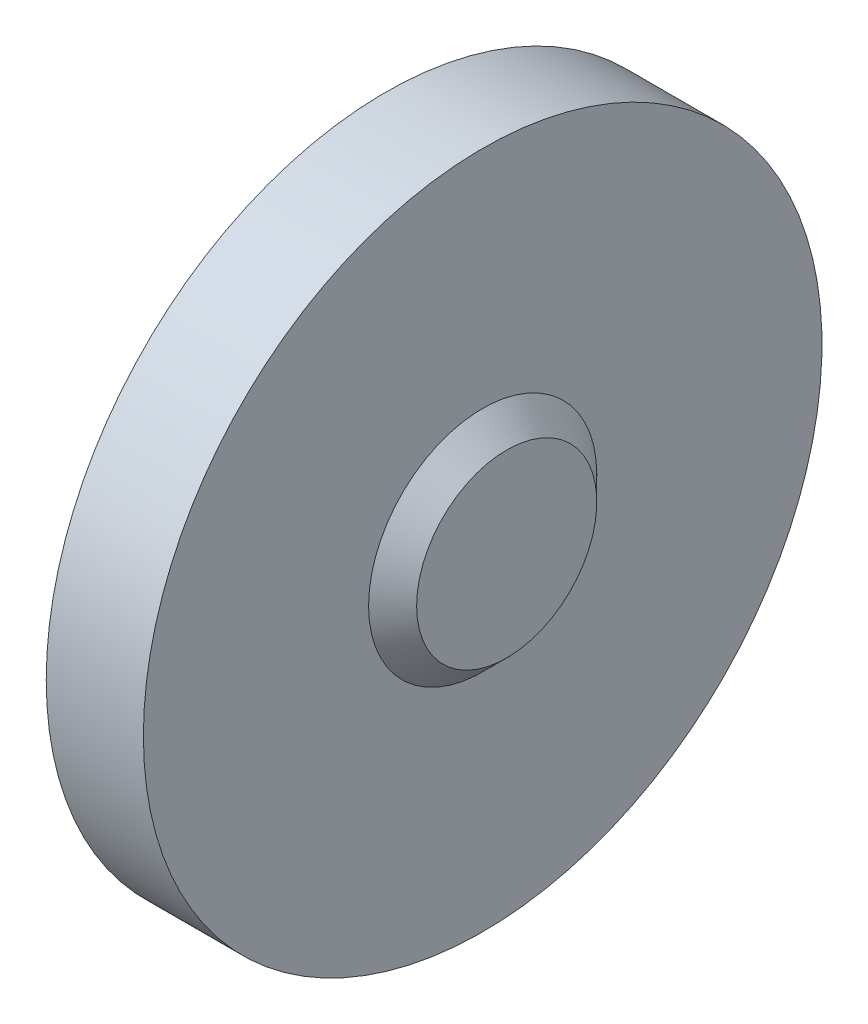
from build123d import *


with BuildPart() as part:
    # Croquis1 → Revolución2 (revolve)
    with BuildSketch(Plane.XY, mode=Mode.PRIVATE) as revoluci_n2_sk:
        Polygon((-1.982300885, 9.415929204), (-1.982300885, 28), (-10, 28), (-10, 21.309734513), (-5, 21.309734513), (-5, 7.433628319), (-12, 7.433628319), (-12, 0), (0, 0), (0, 7.433628319), align=None)
    revolve(revoluci_n2_sk.sketch.rotate(Axis((-12, 0, 0), (1, 0, 0)), 90), axis=Axis((-12, 0, 0), (1, 0, 0)))


solid = part.part
